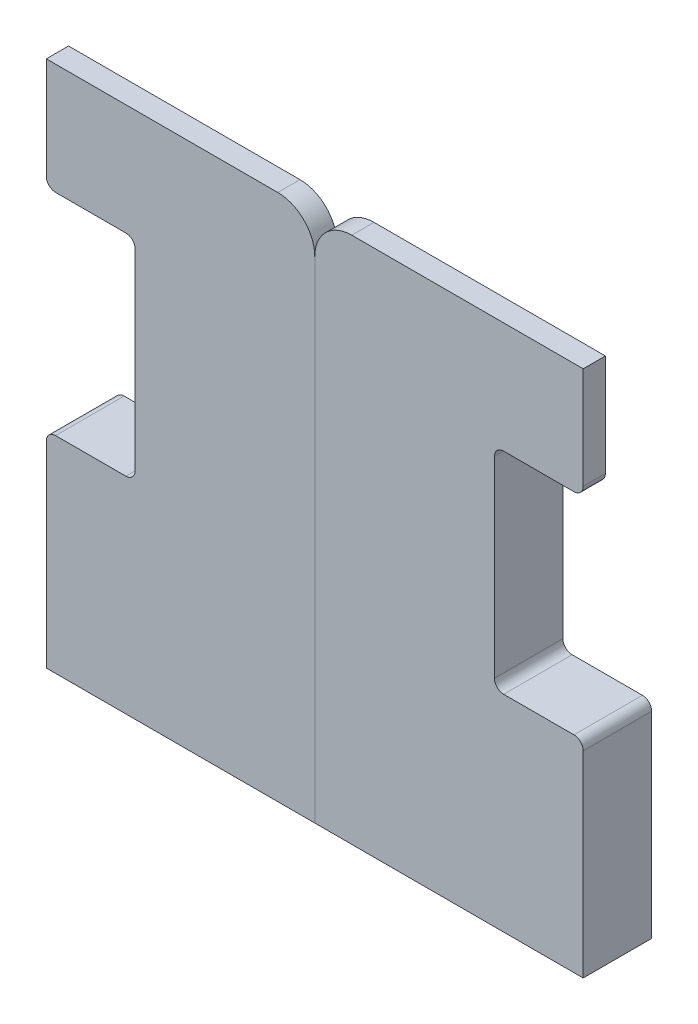
from build123d import *

# Parameters (mm, degrees)
SKETCH1_W           = 17
SKETCH1_H           = 45
BOSS_EXTRUDE1_DEPTH = 12
BOSS_EXTRUDE2_DEPTH = 7
FILLET1_R           = 4
CUT_EXTRUDE1_DEPTH  = 42.886752082
CUT_EXTRUDE2_START  = -4.6
CUT_EXTRUDE2_DEPTH  = 4.6
FILLET2_R           = 1
FILLET3_R           = 1


with BuildPart() as part:
    # Sketch1 → Boss-Extrude1 (new body)
    with BuildSketch(Plane.XY):
        Rectangle(SKETCH1_W, SKETCH1_H)
    extrude(amount=BOSS_EXTRUDE1_DEPTH)

    # Sketch2 → Boss-Extrude2 (add)
    with BuildSketch(Plane.XY.offset(12)):
        Polygon((-8.5, -22.5), (-8.5, 22.5), (8.5, 22.5), (8.5, 34.5), (-20.5, 34.5), (-20.5, -22.5), align=None)
    extrude(amount=-BOSS_EXTRUDE2_DEPTH)

    # Fillet1
    fillet1_edges = [part.edges().sort_by_distance(p)[0] for p in [
        (-20.5, 34.5, 8.5),
    ]]
    fillet(fillet1_edges, radius=FILLET1_R)

    # Sketch3 → Cut-Extrude1 (cut, through all)
    with BuildSketch(Plane(origin=(0, 0, 0), x_dir=(-1, 0, 0), z_dir=(0, 0, -1))):
        Polygon((-2.5, -0.25), (1.091673087, -0.25), (1.091673087, 22.5), (-8.5, 22.5), (-8.5, -0.25), (-3.5, -0.25), align=None)
    extrude(amount=-CUT_EXTRUDE1_DEPTH, mode=Mode.SUBTRACT)

    # Sketch4 → Cut-Extrude2 (cut)
    with BuildSketch(Plane.XY.offset(12).offset(CUT_EXTRUDE2_START)):
        with BuildLine():
            Line((-1.091673087, -0.25), (-1.091673087, 22.5))
            Line((-1.091673087, 22.5), (8.5, 22.5))
            Line((8.5, 22.5), (8.5, 34.5))
            Line((8.5, 34.5), (-16.5, 34.5))
            ThreePointArc((-16.5, 34.5), (-19.328427125, 33.328427125), (-20.5, 30.5))
            Line((-20.5, 30.5), (-20.5, -22.5))
            Line((-20.5, -22.5), (8.5, -22.5))
            Line((8.5, -22.5), (8.5, -0.25))
            Line((8.5, -0.25), (-1.091673087, -0.25))
        make_face()
    extrude(amount=CUT_EXTRUDE2_DEPTH, mode=Mode.SUBTRACT)

    # Fillet2
    fillet2_edges = [part.edges().sort_by_distance(p)[0] for p in [
        (-1.091673087, -0.25, 3.7),
        (8.5, -0.25, 3.7),
        (-1.091673087, 22.5, 6.2),
        (8.5, 22.5, 6.2),
    ]]
    fillet(fillet2_edges, radius=FILLET2_R)

    # Fillet3
    fillet3_edges = [part.edges().sort_by_distance(p)[0] for p in [
        (-8.5, -22.5, 2.5),
        (-1.091673087, 22.5, 2.5),
        (-8.5, 22.5, 2.5),
    ]]
    fillet(fillet3_edges, radius=FILLET3_R)


with BuildPart() as body_2:
    # Mirror1: mirrored copy
    add(part.part.mirror(Plane(origin=(-20.5, 34.5, 5), x_dir=(0, 0, 1), z_dir=(-1, 0, 0))))


solid = Compound([part.part, body_2.part])
